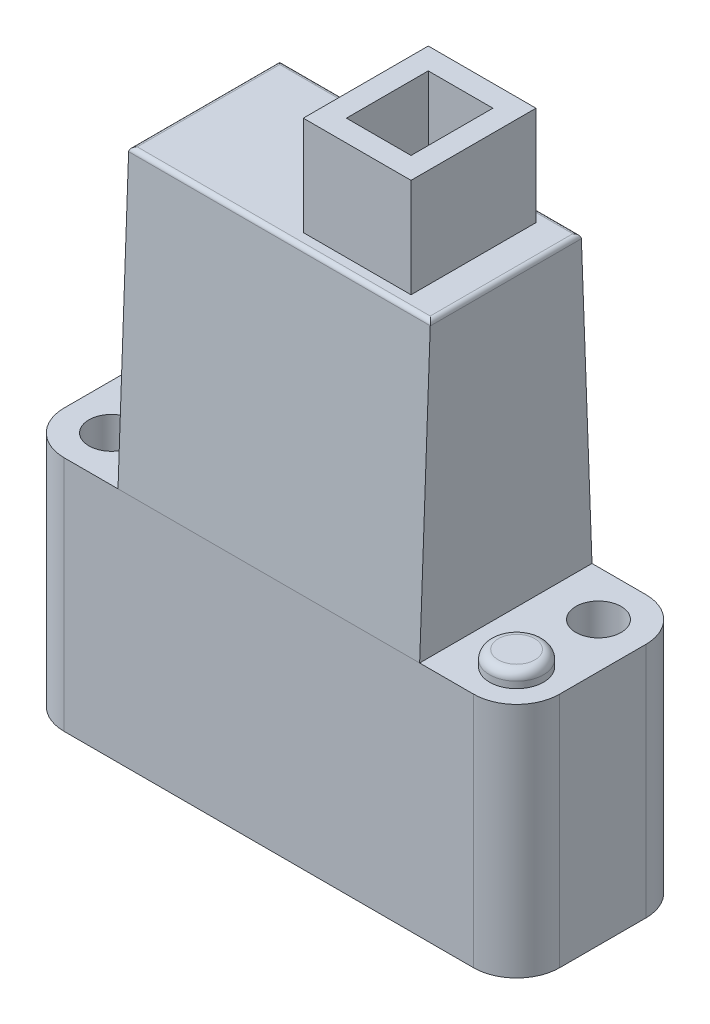
from build123d import *

# Parameters (mm, degrees)
SKETCH1_W           = 14
SKETCH1_H           = 13.5
SKETCH1_W_2         = 23
SKETCH1_H_2         = 11
BOSS_EXTRUDE1_DEPTH = 4
FILLET1_R           = 2
CUT_EXTRUDE1_DEPTH  = 28.358728041
FILLET2_R           = 0.2
SKETCH3_R           = 1.05
CUT_EXTRUDE2_DEPTH  = 19.179658963
SKETCH5_R           = 1.25
BOSS_EXTRUDE2_DEPTH = 0.7
FILLET3_R           = 0.4
SKETCH6_W           = 5
SKETCH6_H           = 5.8
SKETCH6_W_2         = 3
SKETCH6_H_2         = 3.8
BOSS_EXTRUDE3_DEPTH = 4.6
SKETCH7_R           = 1.397
CUT_EXTRUDE3_DEPTH  = 0.762
SKETCH9_R           = 0.508
LPATTERN5_COUNT     = 2
LPATTERN5_PITCH     = 5
LPATTERN5_2_COUNT   = 2
LPATTERN5_2_PITCH   = 5


with BuildPart() as part:
    # Sketch1 → Boss-Extrude1 (new, symmetric)
    with BuildSketch(Plane.XY):
        with Locations((0, 17.75)):
            Rectangle(SKETCH1_W, SKETCH1_H)
        with Locations((0, 5.5)):
            Rectangle(SKETCH1_W_2, SKETCH1_H_2)
    extrude(amount=BOSS_EXTRUDE1_DEPTH, both=True)

    # Fillet1
    fillet1_edges = [part.edges().sort_by_distance(p)[0] for p in [
        (-11.5, 5.5, -4),
        (-11.5, 5.5, 4),
        (11.5, 5.5, 4),
        (11.5, 5.5, -4),
    ]]
    fillet(fillet1_edges, radius=FILLET1_R)

    # Sketch2 → Cut-Extrude1 (cut, symmetric)
    with BuildSketch(Plane(origin=(0, 0, 0), x_dir=(0, 0, -1), z_dir=(1, 0, 0))):
        Polygon((-4, 24.5), (-3.5, 24.5), (-4, 11), align=None)
    cut_extrude1 = extrude(amount=CUT_EXTRUDE1_DEPTH, both=True, mode=Mode.SUBTRACT)

    # Mirror1: Cut-Extrude1 across plane
    add(cut_extrude1.mirror(Plane.XY), mode=Mode.SUBTRACT)

    # Fillet2
    fillet2_edges = [part.edges().sort_by_distance(p)[0] for p in [
        (-7, 24.5, 0),
        (7, 24.5, 0),
        (0, 24.5, 3.5),
        (0, 24.5, -3.5),
    ]]
    fillet(fillet2_edges, radius=FILLET2_R)

    # Sketch3 → Cut-Extrude2 (cut, through all)
    with BuildSketch(Plane(origin=(0, 11, 0), x_dir=(1, 0, 0), z_dir=(0, 1, 0))):
        with Locations(Location((9.4, 1.9, 0), (0, 0, 180))):
            Circle(SKETCH3_R)
        with Locations(Location((-9.4, -1.9, 0), (0, 0, 180))):
            Circle(SKETCH3_R)
    extrude(amount=-CUT_EXTRUDE2_DEPTH, mode=Mode.SUBTRACT)

    # Sketch5 → Boss-Extrude2 (add)
    with BuildSketch(Plane(origin=(0, 11, 0), x_dir=(1, 0, 0), z_dir=(0, 1, 0))):
        with Locations(Location((9.4, -1.9, 0), (0, 0, 180))):
            Circle(SKETCH5_R)
        with Locations(Location((-9.4, 1.9, 0), (0, 0, 180))):
            Circle(SKETCH5_R)
    extrude(amount=BOSS_EXTRUDE2_DEPTH)

    # Fillet3
    fillet3_edges = [part.edges().sort_by_distance(p)[0] for p in [
        (10.65, 11.7, 1.9),
        (-8.15, 11.7, -1.9),
    ]]
    fillet(fillet3_edges, radius=FILLET3_R)

    # Sketch6 → Boss-Extrude3 (add)
    with BuildSketch(Plane(origin=(0, 24.5, 0), x_dir=(1, 0, 0), z_dir=(0, 1, 0))):
        with Locations((3, 0)):
            Rectangle(SKETCH6_W, SKETCH6_H)
        with Locations((3, 0)):
            Rectangle(SKETCH6_W_2, SKETCH6_H_2, mode=Mode.SUBTRACT)
    extrude(amount=BOSS_EXTRUDE3_DEPTH)

    # Sketch7 → Cut-Extrude3 (cut)
    with BuildSketch(Plane.XZ):
        Circle(SKETCH7_R)
        with Locations((5, 0)):
            Circle(SKETCH7_R)
        with Locations((-5, 0)):
            Circle(SKETCH7_R)
    extrude(amount=-CUT_EXTRUDE3_DEPTH, mode=Mode.SUBTRACT)


with BuildPart() as body_2:
    # Sketch9 → Revolve1 (revolve)
    with BuildSketch(Plane.XY, mode=Mode.PRIVATE) as revolve1_sk:
        with Locations((0.8763, 0.254)):
            Circle(SKETCH9_R)
    revolve(revolve1_sk.sketch.rotate(Axis((0, 0, 0), (0, -1, 0)), 90), axis=Axis((0, 0, 0), (0, -1, 0)))


with BuildPart() as lpattern5_1:
    # LPattern5: pattern copy
    add(body_2.part.moved(Location(Vector(-1, 0, 0) * (1 * LPATTERN5_PITCH))))


with BuildPart() as lpattern5_2_1:
    # LPattern5 2: pattern copy
    add(body_2.part.moved(Location(Vector(1, 0, 0) * (1 * LPATTERN5_2_PITCH))))


solid = Compound([part.part, body_2.part, lpattern5_1.part, lpattern5_2_1.part])
